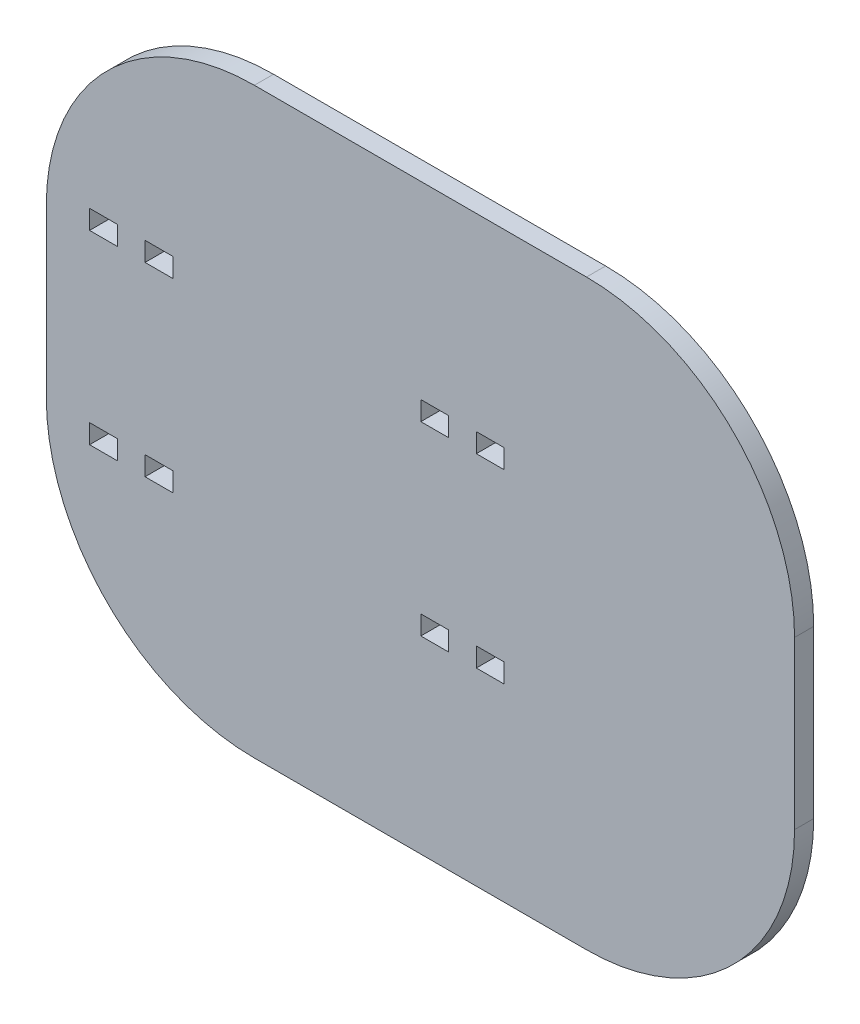
from build123d import *

# Parameters (mm, degrees)
SKETCH1_W           = 228.346
SKETCH1_H           = 177.8
BOSS_EXTRUDE1_DEPTH = 5.842
FILLET1_R           = 63.5
FILLET2_R           = 63.5
FILLET3_R           = 63.5
SKETCH2_W           = 8.466666667
SKETCH2_H           = 5.842
CUT_EXTRUDE1_DEPTH  = 145.819932651


with BuildPart() as part:
    # Sketch1 → Boss-Extrude1 (new body)
    with BuildSketch(Plane.XY):
        Rectangle(SKETCH1_W, SKETCH1_H)
    extrude(amount=BOSS_EXTRUDE1_DEPTH)

    # Fillet1
    fillet1_edges = [part.edges().sort_by_distance(p)[0] for p in [
        (-114.173, 88.9, 2.921),
    ]]
    fillet(fillet1_edges, radius=FILLET1_R)

    # Fillet2
    fillet2_edges = [part.edges().sort_by_distance(p)[0] for p in [
        (-114.173, -88.9, 2.921),
    ]]
    fillet(fillet2_edges, radius=FILLET2_R)

    # Fillet3
    fillet3_edges = [part.edges().sort_by_distance(p)[0] for p in [
        (114.173, 88.9, 2.921),
        (114.173, -88.9, 2.921),
    ]]
    fillet(fillet3_edges, radius=FILLET3_R)

    # Sketch2 → Cut-Extrude1 (cut, through all)
    with BuildSketch(Plane.XY.offset(5.842)):
        with Locations((4.360333334, -28.321)):
            Rectangle(SKETCH2_W, SKETCH2_H)
        with Locations((21.293666667, -28.321)):
            Rectangle(SKETCH2_W, SKETCH2_H)
        with Locations((4.360333334, 28.321)):
            Rectangle(SKETCH2_W, SKETCH2_H)
        with Locations((21.293666667, 28.321)):
            Rectangle(SKETCH2_W, SKETCH2_H)
        with Locations((-96.731666667, -28.321)):
            Rectangle(SKETCH2_W, SKETCH2_H)
        with Locations((-79.798333334, -28.321)):
            Rectangle(SKETCH2_W, SKETCH2_H)
        with Locations((-96.731666667, 28.321)):
            Rectangle(SKETCH2_W, SKETCH2_H)
        with Locations((-79.798333334, 28.321)):
            Rectangle(SKETCH2_W, SKETCH2_H)
    extrude(amount=-CUT_EXTRUDE1_DEPTH, mode=Mode.SUBTRACT)


solid = part.part
